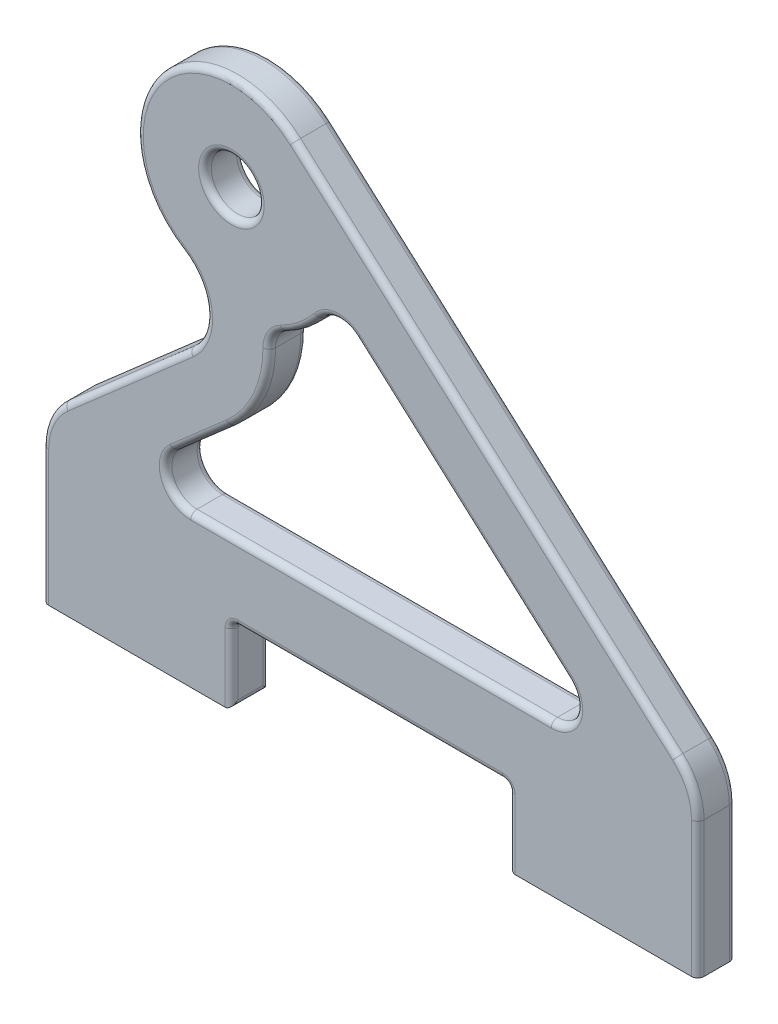
from build123d import *

# Parameters (mm, degrees)
SKETCH1_R           = 2.1
BOSS_EXTRUDE1_DEPTH = 3
FILLET1_R           = 5
CUT_EXTRUDE1_DEPTH  = 10
FILLET2_R           = 0.5


with BuildPart() as part:
    # Sketch1 → Boss-Extrude1 (new body)
    with BuildSketch(Plane.XY):
        with BuildLine():
            Line((0, 0), (15, 0))
            Line((15, 0), (15, 6))
            Line((15, 6), (37, 6))
            Line((37, 6), (37, 0))
            Line((37, 0), (52, 0))
            Line((52, 0), (52, 13))
            Line((52, 13), (19.996940762, 41.592904704))
            ThreePointArc((19.996940762, 41.592904704), (8.979959751, 40.473154971), (11.086956522, 29.60171189))
            ThreePointArc((11.086956522, 29.60171189), (12.985575047, 26.528690369), (11.63390392, 23.178884593))
            Line((11.63390392, 23.178884593), (0, 13))
            Line((0, 13), (0, 0))
        make_face()
        with Locations((15, 36)):
            Circle(SKETCH1_R, mode=Mode.SUBTRACT)
    extrude(amount=BOSS_EXTRUDE1_DEPTH)

    # Fillet1
    fillet1_edges = [part.edges().sort_by_distance(p)[0] for p in [
        (0, 13, 1.5),
        (52, 13, 1.5),
    ]]
    fillet(fillet1_edges, radius=FILLET1_R)

    # Sketch3 → Cut-Extrude1 (cut)
    with BuildSketch(Plane.XY.offset(3)):
        with BuildLine():
            Line((14.926283821, 19.415875878), (10.456600876, 15.505203486))
            ThreePointArc((10.456600876, 15.505203486), (9.901333969, 13.296582262), (11.773552836, 12))
            Line((11.773552836, 12), (40.374305906, 12))
            ThreePointArc((40.374305906, 12), (42.242845778, 13.286866951), (41.706823442, 15.491441254))
            Line((41.706823442, 15.491441254), (24.86009534, 30.543030154))
            ThreePointArc((24.86009534, 30.543030154), (23.369836338, 31.045358604), (21.977109112, 30.314936373))
            ThreePointArc((21.977109112, 30.314936373), (20.655452205, 28.998867209), (19.090903049, 27.983485031))
            ThreePointArc((19.090903049, 27.983485031), (18.293782453, 27.245515521), (17.999993958, 26.199719861))
            ThreePointArc((17.999993958, 26.199719861), (17.197778778, 22.474937905), (14.926283821, 19.415875878))
        make_face()
    extrude(amount=-CUT_EXTRUDE1_DEPTH, mode=Mode.SUBTRACT)

    # Fillet2
    fillet2_edges = [part.edges().sort_by_distance(p)[0] for p in [
        (15, 3, 3),
        (6.67076201, 18.836468748, 0),
        (12.985575047, 26.528690369, 0),
        (8.979959751, 40.473154971, 0),
        (52, 5.381145232, 0),
        (37, 3, 0),
        (26, 6, 0),
        (26, 6, 3),
        (15, 3, 0),
        (37, 3, 3),
        (37, 0, 1.5),
        (37, 6, 1.5),
        (15, 6, 1.5),
        (15, 0, 1.5),
        (52, 5.381145232, 3),
        (12.9, 36, 0),
        (12.9, 36, 3),
        (8.979959751, 40.473154971, 3),
        (12.985575047, 26.528690369, 3),
        (6.67076201, 18.836468748, 3),
        (0, 5.365522094, 0),
        (0, 5.365522094, 3),
        (35.164117301, 28.041899151, 0),
        (51.563796074, 12.804780463, 0),
        (0.446874727, 12.797212198, 0),
        (35.164117301, 28.041899151, 3),
        (51.563796074, 12.804780463, 3),
        (0.446874727, 12.797212198, 3),
        (12.691442348, 17.460539682, 0),
        (9.901333969, 13.296582262, 0),
        (26.073929371, 12, 0),
        (42.242845778, 13.286866951, 0),
        (33.283459391, 23.017235704, 0),
        (23.369836338, 31.045358604, 0),
        (20.655452205, 28.998867209, 0),
        (18.293782453, 27.245515521, 0),
        (17.197778778, 22.474937905, 0),
        (17.197778778, 22.474937905, 3),
        (12.691442348, 17.460539682, 3),
        (9.901333969, 13.296582262, 3),
        (26.073929371, 12, 3),
        (42.242845778, 13.286866951, 3),
        (33.283459391, 23.017235704, 3),
        (23.369836338, 31.045358604, 3),
        (20.655452205, 28.998867209, 3),
        (18.293782453, 27.245515521, 3),
    ]]
    fillet(fillet2_edges, radius=FILLET2_R)


solid = part.part
